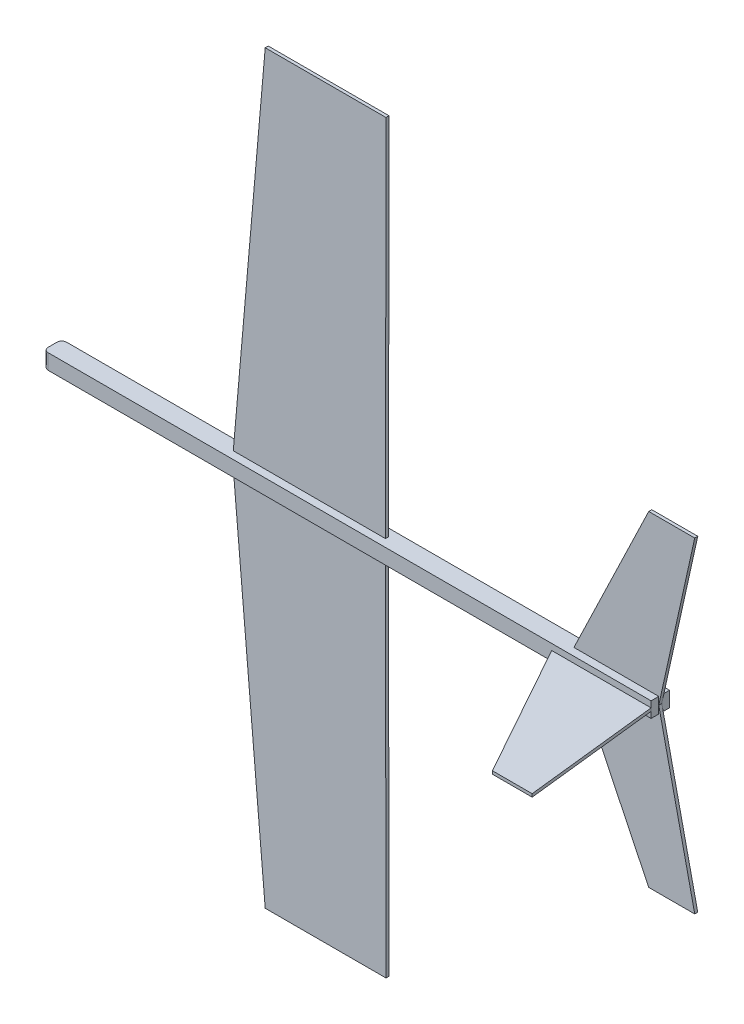
from build123d import *

# Parameters (mm, degrees)
SKETCH1_W           = 318
SKETCH1_H           = 8
BOSS_EXTRUDE1_DEPTH = 4.8
BOSS_EXTRUDE2_DEPTH = 0.79375
BOSS_EXTRUDE3_DEPTH = 0.79375
BOSS_EXTRUDE4_DEPTH = 0.79375
FILLET1_R           = 2.5


with BuildPart() as part:
    # Sketch1 → Boss-Extrude1 (new, symmetric)
    with BuildSketch(Plane.XY):
        Rectangle(SKETCH1_W, SKETCH1_H)
    extrude(amount=BOSS_EXTRUDE1_DEPTH, both=True)

    # Sketch3 → Boss-Extrude2 (add, symmetric)
    with BuildSketch(Plane.XY):
        Polygon((-64, 0), (-46.939710612, 195), (16.260289388, 195), (16, 0), align=None)
    boss_extrude2 = extrude(amount=BOSS_EXTRUDE2_DEPTH, both=True)

    # Mirror1: Boss-Extrude2 across plane
    add(boss_extrude2.mirror(Plane.ZX))

    # Sketch6 → Boss-Extrude3 (add, symmetric)
    with BuildSketch(Plane(origin=(0, 0, 0), x_dir=(1, 0, 0), z_dir=(0, 1, 0))):
        Polygon((159, -4.8), (166.766007972, -74.8), (145.966007972, -74.8), (107, -4.8), align=None)
    extrude(amount=BOSS_EXTRUDE3_DEPTH, both=True)

    # Sketch8 → Boss-Extrude4 (add, symmetric)
    with BuildSketch(Plane.XY):
        Polygon((159, 0), (177.834948036, 85.2), (153.758948036, 85.2), (112.7, 0), align=None)
    boss_extrude4 = extrude(amount=BOSS_EXTRUDE4_DEPTH, both=True)

    # Mirror2: Boss-Extrude4 across plane
    add(boss_extrude4.mirror(Plane.ZX))

    # Fillet1
    fillet1_edges = [part.edges().sort_by_distance(p)[0] for p in [
        (-159, 0, 4.8),
        (-159, 0, -4.8),
    ]]
    fillet(fillet1_edges, radius=FILLET1_R)


solid = part.part
